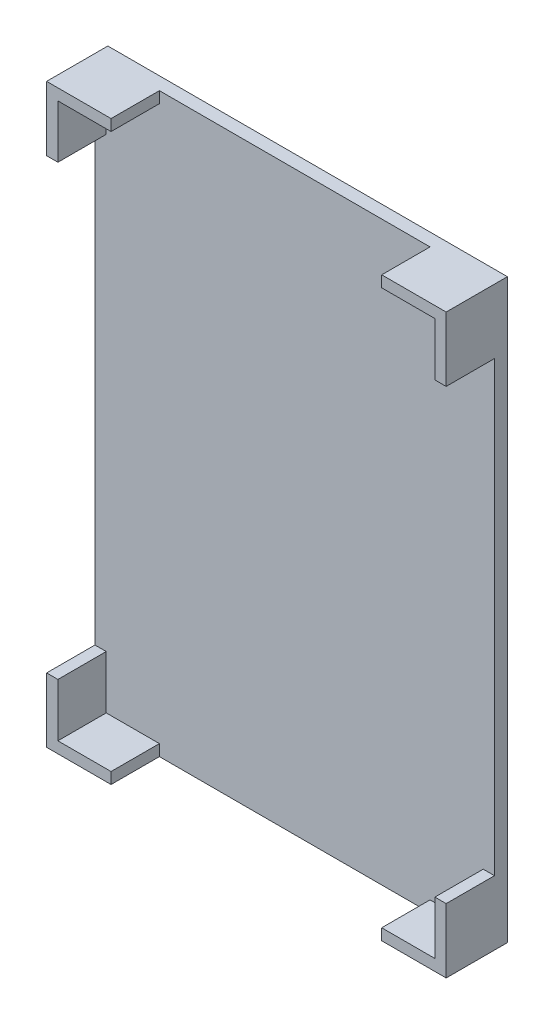
from build123d import *

# Parameters (mm, degrees)
SKETCH_1_W      = 124
SKETCH_1_H      = 179
EXTRUDE_1_DEPTH = 4
EXTRUDE_2_DEPTH = 15


with BuildPart() as part:
    # 草圖1 → 填料-伸長1 (new body)
    with BuildSketch(Plane.XY):
        Rectangle(SKETCH_1_W, SKETCH_1_H)
    extrude(amount=EXTRUDE_1_DEPTH)

    # 草圖3 → 填料-伸長2 (add)
    with BuildSketch(Plane.XY.offset(4)):
        Polygon((-62, 89.5), (-62, 69.5), (-58.5, 69.5), (-58.5, 86), (-42, 86), (-42, 89.5), align=None)
        Polygon((42, 86), (42, 89.5), (62, 89.5), (62, 69.5), (58.5, 69.5), (58.5, 86), align=None)
        Polygon((62, -89.5), (62, -69.5), (58.5, -69.5), (58.5, -86), (42, -86), (42, -89.5), align=None)
        Polygon((-42, -86), (-42, -89.5), (-62, -89.5), (-62, -69.5), (-58.5, -69.5), (-58.5, -86), align=None)
    extrude(amount=EXTRUDE_2_DEPTH)


solid = part.part
